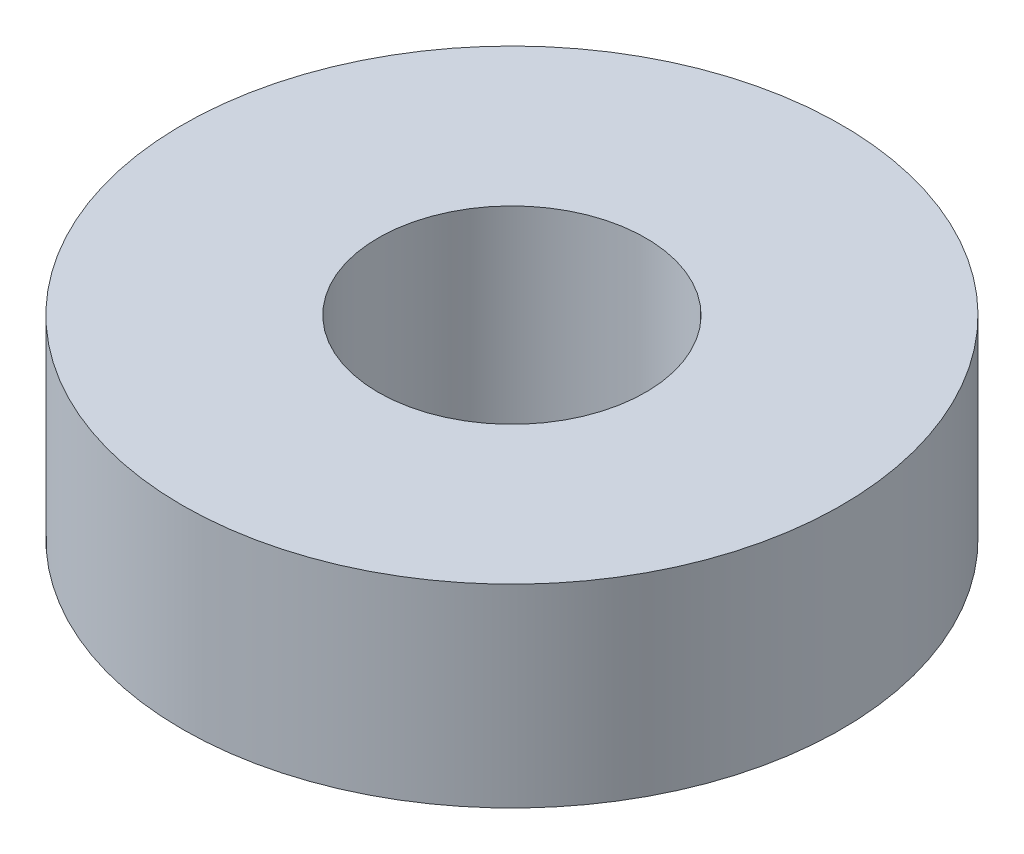
from build123d import *

# Parameters (mm, degrees)
ESQUISSE1_R        = 8.5
ESQUISSE1_R_2      = 3.45
BOSS_EXTRU_1_DEPTH = 5


with BuildPart() as part:
    # Esquisse1 → Boss.-Extru.1 (new body)
    with BuildSketch(Plane(origin=(0, 0, 0), x_dir=(1, 0, 0), z_dir=(0, 1, 0))):
        with Locations(Location((0, 0, 0), (0, 0, 270))):
            Circle(ESQUISSE1_R)
        with Locations(Location((0, 0, 0), (0, 0, 270))):
            Circle(ESQUISSE1_R_2, mode=Mode.SUBTRACT)
    extrude(amount=BOSS_EXTRU_1_DEPTH)


solid = part.part
